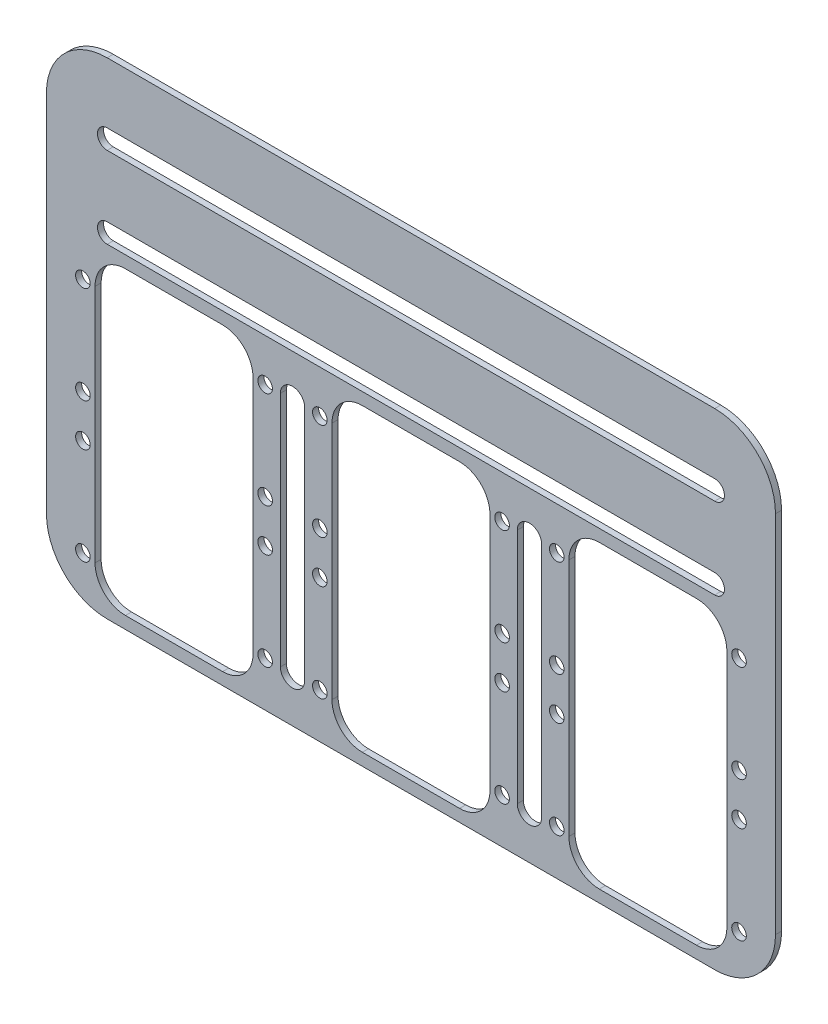
from build123d import *

# Parameters (mm, degrees)
SKETCH1_W            = 120
SKETCH1_H            = 80
PLATE_DEPTH          = 1
SLOT_CUT_DEPTH       = 73.117958928
SECOND_SLOT_COUNT    = 2
SECOND_SLOT_PITCH    = 13.38
MOTOR_OUTLINE_R      = 1.2
MOTOR_MOUNT_DEPTH    = 73.117958928
MOTORS_COUNT         = 3
MOTORS_PITCH         = 39
MOTORS_COUNT_DIR2    = 2
MOTORS_PITCH_DIR2    = 23
MOTOR_CUTOUT_DEPTH   = 73.117958928
CUTOUT_PATTERN_COUNT = 3
CUTOUT_PATTERN_PITCH = 39
FILLET1_R            = 10
CUT_EXTRUDE5_DEPTH   = 73.117958928
LPATTERN6_COUNT      = 2
LPATTERN6_PITCH      = 39


with BuildPart() as part:
    # Sketch1 → plate (new body)
    with BuildSketch(Plane.XY):
        Rectangle(SKETCH1_W, SKETCH1_H)
    extrude(amount=PLATE_DEPTH)

    # Sketch2 → slot_cut (cut, through all)
    with BuildSketch(Plane.XY.offset(1)):
        with BuildLine():
            Line((50, 26.8), (-50, 26.8))
            ThreePointArc((-50, 26.8), (-51.6, 28.4), (-50, 30))
            Line((-50, 30), (50, 30))
            ThreePointArc((50, 30), (51.6, 28.4), (50, 26.8))
        make_face()
    slot_cut = extrude(amount=-SLOT_CUT_DEPTH, mode=Mode.SUBTRACT)

    # second_slot: slot_cut ×2
    with Locations(*[(0, -i * SECOND_SLOT_PITCH, 0) for i in range(1, SECOND_SLOT_COUNT)]):
        add(slot_cut, mode=Mode.SUBTRACT)

    # motor_outline → motor_mount (cut, through all)
    with BuildSketch(Plane.XY.offset(1)):
        with Locations((-54, 6.42)):
            Circle(MOTOR_OUTLINE_R)
        with Locations((-54, -9.58)):
            Circle(MOTOR_OUTLINE_R)
        with Locations((-24, -9.58)):
            Circle(MOTOR_OUTLINE_R)
        with Locations((-24, 6.42)):
            Circle(MOTOR_OUTLINE_R)
    motor_mount = extrude(amount=-MOTOR_MOUNT_DEPTH, mode=Mode.SUBTRACT)

    # motors: motor_mount 3 × 2
    with Locations(*[(i * MOTORS_PITCH, -j * MOTORS_PITCH_DIR2, 0) for i in range(MOTORS_COUNT) for j in range(MOTORS_COUNT_DIR2) if (i, j) != (0, 0)]):
        add(motor_mount, mode=Mode.SUBTRACT)

    # motor_outline<5> → motor_cutout (cut, through all)
    with BuildSketch(Plane.XY.offset(1)):
        with BuildLine():
            Line((-26, -33), (-26, 6.42))
            ThreePointArc((-26, 6.42), (-27.464466094, 9.955533906), (-31, 11.42))
            Line((-31, 11.42), (-47, 11.42))
            ThreePointArc((-47, 11.42), (-50.535533906, 9.955533906), (-52, 6.42))
            Line((-52, 6.42), (-52, -33))
            ThreePointArc((-52, -33), (-50.535533906, -36.535533906), (-47, -38))
            Line((-47, -38), (-31, -38))
            ThreePointArc((-31, -38), (-27.464466094, -36.535533906), (-26, -33))
        make_face()
    motor_cutout = extrude(amount=-MOTOR_CUTOUT_DEPTH, mode=Mode.SUBTRACT)

    # cutout_pattern: motor_cutout ×3
    with Locations(*[(i * CUTOUT_PATTERN_PITCH, 0, 0) for i in range(1, CUTOUT_PATTERN_COUNT)]):
        add(motor_cutout, mode=Mode.SUBTRACT)

    # Fillet1
    fillet1_edges = [part.edges().sort_by_distance(p)[0] for p in [
        (-60, -40, 0.5),
        (60, -40, 0.5),
        (60, 40, 0.5),
        (-60, 40, 0.5),
    ]]
    fillet(fillet1_edges, radius=FILLET1_R)

    # Sketch4 → Cut-Extrude5 (cut, through all)
    with BuildSketch(Plane.XY.offset(1)):
        with BuildLine():
            Line((-17.5, 6.42), (-17.5, -32.58))
            ThreePointArc((-17.5, -32.58), (-19.5, -34.58), (-21.5, -32.58))
            Line((-21.5, -32.58), (-21.5, 6.42))
            ThreePointArc((-21.5, 6.42), (-19.5, 8.42), (-17.5, 6.42))
        make_face()
    cut_extrude5 = extrude(amount=-CUT_EXTRUDE5_DEPTH, mode=Mode.SUBTRACT)

    # LPattern6: Cut-Extrude5 ×2
    with Locations(*[(i * LPATTERN6_PITCH, 0, 0) for i in range(1, LPATTERN6_COUNT)]):
        add(cut_extrude5, mode=Mode.SUBTRACT)


solid = part.part
